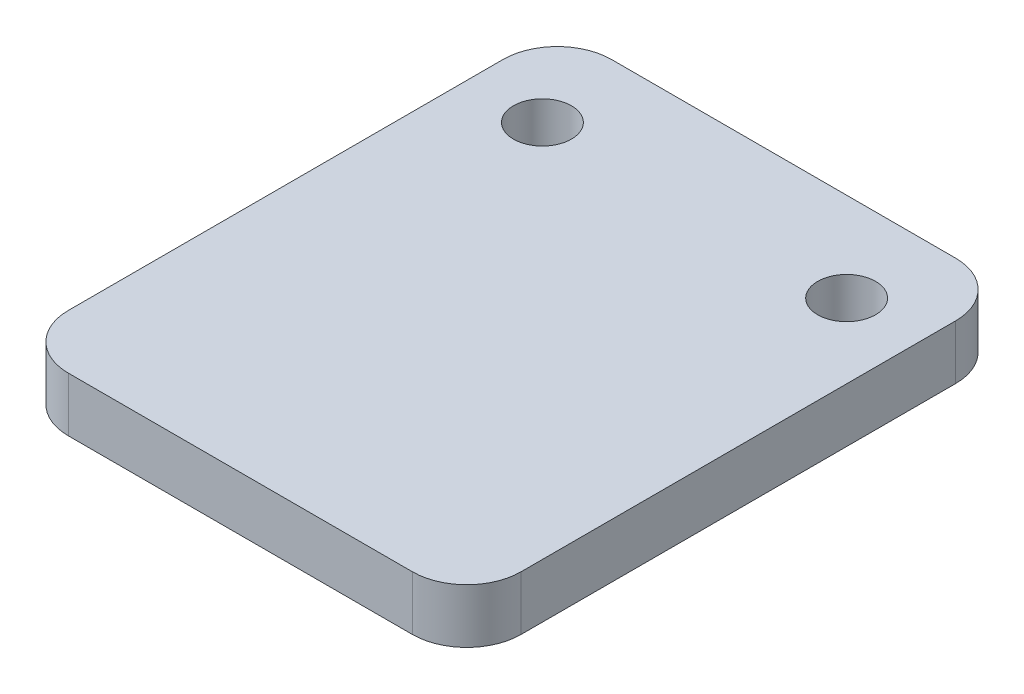
from build123d import *

# Parameters (mm, degrees)
SKETCH1_W           = 25
SKETCH1_H           = 30
SKETCH1_R           = 1.6
BOSS_EXTRUDE1_DEPTH = 1.5
FILLET1_R           = 3


with BuildPart() as part:
    # Sketch1 → Boss-Extrude1 (new, symmetric)
    with BuildSketch(Plane(origin=(0, 0, 0), x_dir=(1, 0, 0), z_dir=(0, 1, 0))):
        Rectangle(SKETCH1_W, SKETCH1_H)
        with Locations(Location((-8.4, 10.08, 0), (0, 0, 270))):
            Circle(SKETCH1_R, mode=Mode.SUBTRACT)
        with Locations(Location((8.4, 10.08, 0), (0, 0, 90))):
            Circle(SKETCH1_R, mode=Mode.SUBTRACT)
    extrude(amount=BOSS_EXTRUDE1_DEPTH, both=True)

    # Fillet1
    fillet1_edges = [part.edges().sort_by_distance(p)[0] for p in [
        (-12.5, 0, -15),
        (12.5, 0, -15),
        (12.5, 0, 15),
        (-12.5, 0, 15),
    ]]
    fillet(fillet1_edges, radius=FILLET1_R)


solid = part.part
